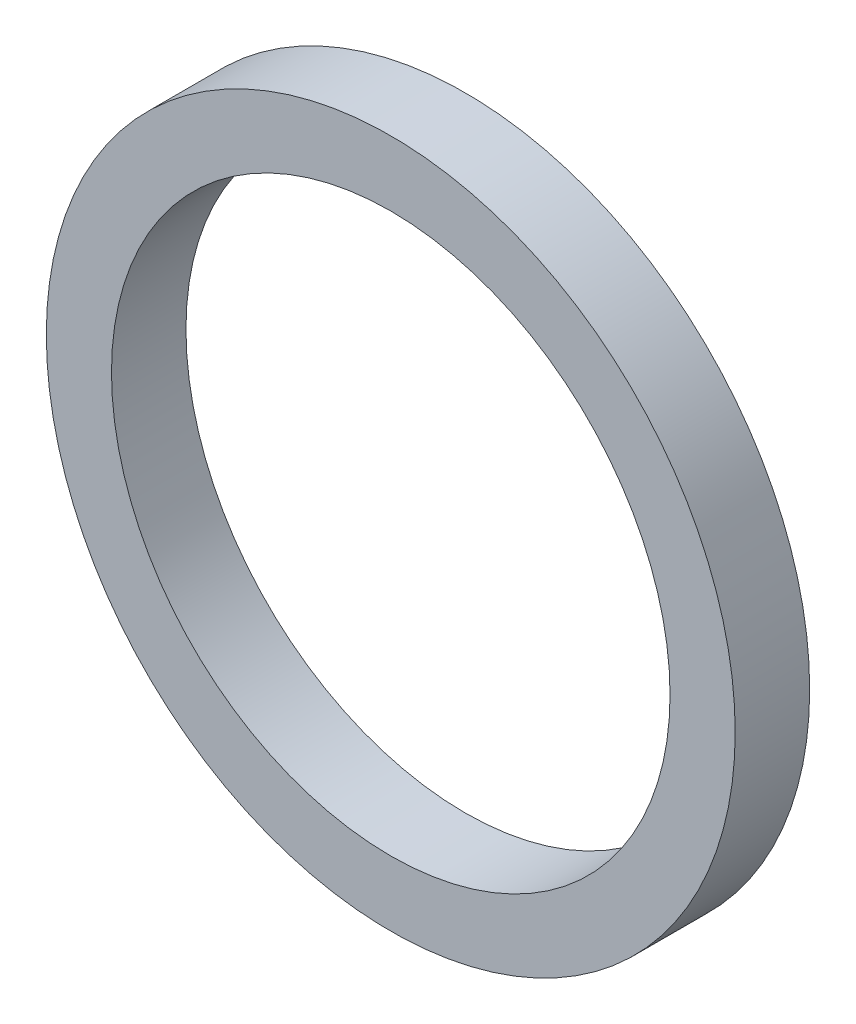
from build123d import *

# Parameters (mm, degrees)
SKETCH1_R           = 18.5
SKETCH1_R_2         = 15
BOSS_EXTRUDE1_DEPTH = 4


with BuildPart() as part:
    # Sketch1 → Boss-Extrude1 (new body)
    with BuildSketch(Plane.XY):
        Circle(SKETCH1_R)
        Circle(SKETCH1_R_2, mode=Mode.SUBTRACT)
    extrude(amount=BOSS_EXTRUDE1_DEPTH)


solid = part.part
